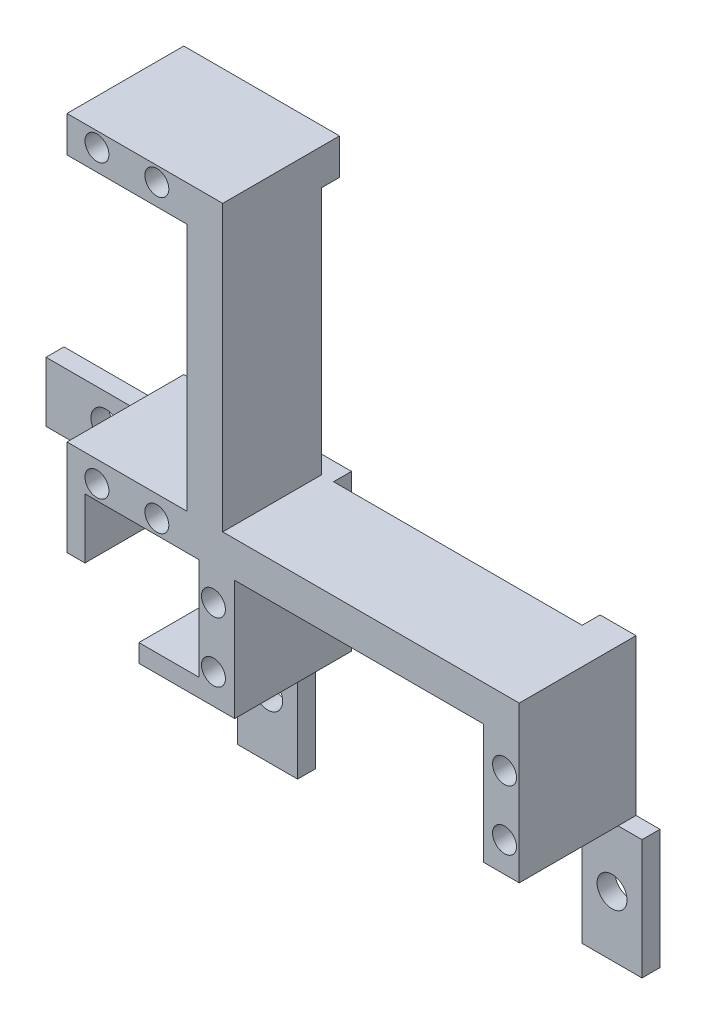
from build123d import *

# Parameters (mm, degrees)
EXTRUDE_1_DEPTH     = 16.5
SKETCH_3_W          = 10
SKETCH_3_H          = 16.5
CUT_EXTRUDE_2_DEPTH = 3
SKETCH_4_W          = 11.896315449
SKETCH_4_H          = 29.084641161
CUT_EXTRUDE_3_DEPTH = 48.945933091
SKETCH_5_R          = 2
CUT_EXTRUDE_4_DEPTH = 48.945933091
SKETCH_6_W          = 10
SKETCH_6_H          = 23
EXTRUDE_2_DEPTH     = 3
SKETCH_7_R          = 2.5
CUT_EXTRUDE_5_DEPTH = 3
EXTRUDE_START       = 3
SKETCH_8_R          = 2
SKETCH_8_W          = 6
SKETCH_8_H          = 26
EXTRUDE_3_DEPTH     = 3
SKETCH_9_R          = 2.5
CUT_EXTRUDE_6_DEPTH = 3
SKETCH_10_W         = 74.694005649
SKETCH_10_H         = 52.095093629
CUT_EXTRUDE_7_DEPTH = 116.604119736
SKETCH_13_R         = 2
EXTRUDE_4_DEPTH     = 19.5
SKETCH_14_W         = 6
SKETCH_14_H         = 41.5
CUT_EXTRUDE_9_DEPTH = 3
SKETCH_15_W         = 23
SKETCH_15_H         = 10
SKETCH_15_R         = 2.5
EXTRUDE_5_DEPTH     = 3
SKETCH_16_W         = 3
SKETCH_16_H         = 10
EXTRUDE_6_DEPTH     = 16.5


with BuildPart() as part:
    # 草图1 → 凸台-拉伸1 (new body)
    with BuildSketch(Plane.XY):
        Polygon((0, 0), (26.75, 0), (26.75, -20), (36.75, -20), (36.75, -26), (20.75, -26), (20.75, -6), (0, -6), (-20.75, -6), (-20.75, -26), (-36.75, -26), (-36.75, -20), (-26.75, -20), (-26.75, 0), align=None)
    extrude(amount=EXTRUDE_1_DEPTH)

    # 草图3 → 切除-拉伸2 (cut)
    with BuildSketch(Plane(origin=(0, -20, 0), x_dir=(1, 0, 0), z_dir=(0, 1, 0))):
        with Locations((31.75, -8.25)):
            Rectangle(SKETCH_3_W, SKETCH_3_H)
    extrude(amount=-CUT_EXTRUDE_2_DEPTH, mode=Mode.SUBTRACT)

    # 草图4 → 切除-拉伸3 (cut, through all)
    with BuildSketch(Plane.XY.offset(16.5)):
        with Locations((-32.698157724, -14.542320581)):
            Rectangle(SKETCH_4_W, SKETCH_4_H)
    extrude(amount=-CUT_EXTRUDE_3_DEPTH, mode=Mode.SUBTRACT)

    # 草图5 → 切除-拉伸4 (cut, through all)
    with BuildSketch(Plane(origin=(0, 0, 0), x_dir=(-1, 0, 0), z_dir=(0, 0, -1))):
        with Locations((-24.3, -11)):
            Circle(SKETCH_5_R)
        with Locations((-24.3, -21)):
            Circle(SKETCH_5_R)
        with Locations(Location((24.3, -21, 0), (0, 0, 180))):
            Circle(SKETCH_5_R)
        with Locations(Location((24.3, -11, 0), (0, 0, 180))):
            Circle(SKETCH_5_R)
    extrude(amount=-CUT_EXTRUDE_4_DEPTH, mode=Mode.SUBTRACT)

    # 草图6 → 凸台-拉伸2 (add)
    with BuildSketch(Plane(origin=(0, 0, 0), x_dir=(-1, 0, 0), z_dir=(0, 0, -1))):
        with Locations((-31.75, -34.5)):
            Rectangle(SKETCH_6_W, SKETCH_6_H)
    extrude(amount=EXTRUDE_2_DEPTH)

    # 草图7 → 切除-拉伸5 (cut)
    with BuildSketch(Plane(origin=(0, 0, -3), x_dir=(-1, 0, 0), z_dir=(0, 0, -1))):
        with Locations((-31.75, -36)):
            Circle(SKETCH_7_R)
    extrude(amount=-CUT_EXTRUDE_5_DEPTH, mode=Mode.SUBTRACT)

    # 草图8 → 凸台-拉伸3 (add)
    # profile 1 of 2: a face of its own
    with BuildSketch(Plane(origin=(0, 0, 0), x_dir=(-1, 0, 0), z_dir=(0, 0, -1)).offset(EXTRUDE_START)):
        Polygon((26.75, 0), (20.75, 0), (20.75, -46), (26.75, -46), (30.75, -46), (30.75, -26), (26.75, -26), align=None)
        with Locations((24.3, -21)):
            Circle(SKETCH_8_R, mode=Mode.SUBTRACT)
        with Locations((24.3, -11)):
            Circle(SKETCH_8_R, mode=Mode.SUBTRACT)
    # profile 2 of 2: a face of its own
    with BuildSketch(Plane(origin=(0, 0, 0), x_dir=(-1, 0, 0), z_dir=(0, 0, -1)).offset(EXTRUDE_START)):
        with Locations((-23.75, -13)):
            Rectangle(SKETCH_8_W, SKETCH_8_H)
        with Locations((-24.3, -11)):
            Circle(SKETCH_8_R, mode=Mode.SUBTRACT)
        with Locations((-24.3, -21)):
            Circle(SKETCH_8_R, mode=Mode.SUBTRACT)
    extrude(amount=-EXTRUDE_3_DEPTH)

    # 草图9 → 切除-拉伸6 (cut)
    with BuildSketch(Plane(origin=(0, 0, -3), x_dir=(-1, 0, 0), z_dir=(0, 0, -1))):
        with Locations((25.75, -36)):
            Circle(SKETCH_9_R)
    extrude(amount=-CUT_EXTRUDE_6_DEPTH, mode=Mode.SUBTRACT)

    # 镜向1: part across plane


with BuildPart() as part_1:
    add(part.part)
    add(part.part.mirror(Plane(origin=(36.75, -20, 16.5), x_dir=(0, 0, 1), z_dir=(-1, 0, 0))))

    # 草图10 → 切除-拉伸7 (cut, through all)
    with BuildSketch(Plane(origin=(0, 0, -3), x_dir=(-1, 0, 0), z_dir=(0, 0, -1))):
        with Locations((0.597002825, -19.952453186)):
            Rectangle(SKETCH_10_W, SKETCH_10_H)
    extrude(amount=-CUT_EXTRUDE_7_DEPTH, mode=Mode.SUBTRACT)

    # 草图13 → 凸台-拉伸4 (add)
    with BuildSketch(Plane(origin=(0, 0, -3), x_dir=(-1, 0, 0), z_dir=(0, 0, -1))):
        Polygon((-24.75, -6), (-50.75, -6), (-50.75, 47.5), (-24.75, 47.5), (-24.75, 41.5), (-44.75, 41.5), (-44.75, 0), (-24.75, 0), align=None)
        with Locations((-29.75, -3.55)):
            Circle(SKETCH_13_R, mode=Mode.SUBTRACT)
        with Locations((-39.75, -3.55)):
            Circle(SKETCH_13_R, mode=Mode.SUBTRACT)
        with Locations(Location((-39.75, 45.05, 0), (0, 0, 180))):
            Circle(SKETCH_13_R, mode=Mode.SUBTRACT)
        with Locations(Location((-29.75, 45.05, 0), (0, 0, 180))):
            Circle(SKETCH_13_R, mode=Mode.SUBTRACT)
    extrude(amount=-EXTRUDE_4_DEPTH)

    # 草图14 → 切除-拉伸9 (cut)
    with BuildSketch(Plane(origin=(0, 0, -3), x_dir=(-1, 0, 0), z_dir=(0, 0, -1))):
        with Locations((-47.75, 20.75)):
            Rectangle(SKETCH_14_W, SKETCH_14_H)
    extrude(amount=-CUT_EXTRUDE_9_DEPTH, mode=Mode.SUBTRACT)

    # 草图15 → 凸台-拉伸5 (add)
    with BuildSketch(Plane(origin=(0, 0, -3), x_dir=(-1, 0, 0), z_dir=(0, 0, -1))):
        with Locations((-16.25, -11)):
            Rectangle(SKETCH_15_W, SKETCH_15_H)
        with Locations((-14.75, -11)):
            Circle(SKETCH_15_R, mode=Mode.SUBTRACT)
    extrude(amount=-EXTRUDE_5_DEPTH)

    # 草图16 → 凸台-拉伸6 (add)
    with BuildSketch(Plane.XY):
        with Locations((26.25, -11)):
            Rectangle(SKETCH_16_W, SKETCH_16_H)
    extrude(amount=EXTRUDE_6_DEPTH)


solid = part_1.part
